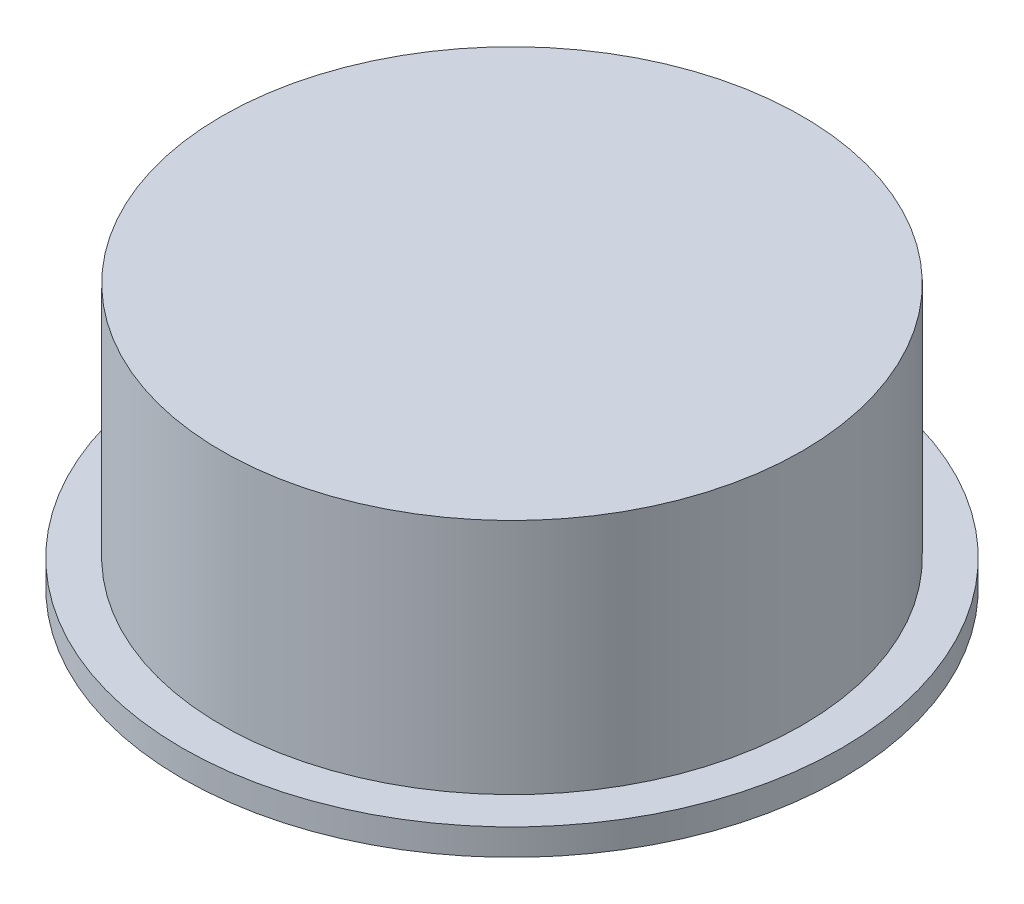
from build123d import *


with BuildPart() as part:
    # Sketch3 → Revolve1 (revolve)
    with BuildSketch(Plane.XY):
        Polygon((-37.5, 0), (-30, 0), (-30, 27), (0, 27), (0, 30), (-33, 30), (-33, 3), (-37.5, 3), align=None)
    revolve(axis=Axis((0, 18.189160045, 0), (0, -1, 0)))


solid = part.part
